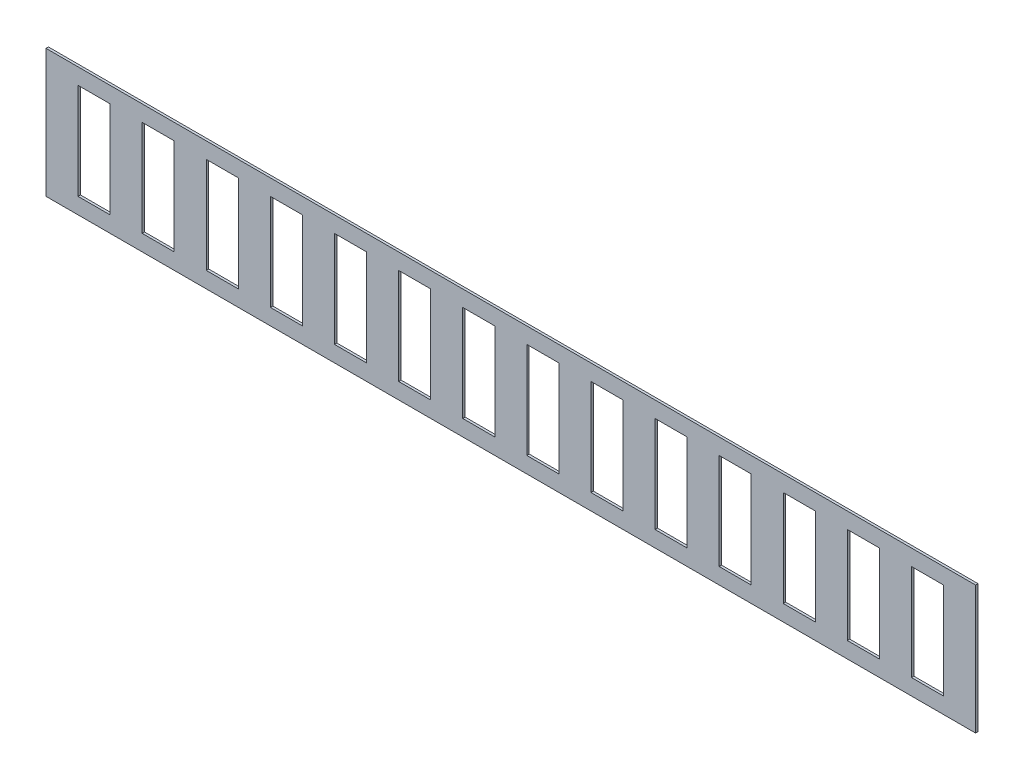
from build123d import *

# Parameters (mm, degrees)
OVEN_PLINT_IZGARA_PANELI_1_START  = 18.5
SKETCH1_W                         = 580
SKETCH1_H                         = 80
OVEN_PLINT_IZGARA_PANELI_1_DEPTH  = 1.5
OVEN_PLINT_IZGARA_PANELI_2_START  = 17
SKETCH2_W                         = 20
SKETCH2_H                         = 60
OVEN_PLINT_IZGARA_PANELI_2_DEPTH  = 4
OVEN_PLINT_IZGARA_PANELI_3_START  = 17
SKETCH3_W                         = 20
SKETCH3_H                         = 60
OVEN_PLINT_IZGARA_PANELI_3_DEPTH  = 4
OVEN_PLINT_IZGARA_PANELI_4_START  = 17
SKETCH4_W                         = 20
SKETCH4_H                         = 60
OVEN_PLINT_IZGARA_PANELI_4_DEPTH  = 4
OVEN_PLINT_IZGARA_PANELI_5_START  = 17
SKETCH5_W                         = 20
SKETCH5_H                         = 60
OVEN_PLINT_IZGARA_PANELI_5_DEPTH  = 4
OVEN_PLINT_IZGARA_PANELI_6_START  = 17
SKETCH6_W                         = 20
SKETCH6_H                         = 60
OVEN_PLINT_IZGARA_PANELI_6_DEPTH  = 4
OVEN_PLINT_IZGARA_PANELI_7_START  = 17
SKETCH7_W                         = 20
SKETCH7_H                         = 60
OVEN_PLINT_IZGARA_PANELI_7_DEPTH  = 4
OVEN_PLINT_IZGARA_PANELI_8_START  = 17
SKETCH8_W                         = 20
SKETCH8_H                         = 60
OVEN_PLINT_IZGARA_PANELI_8_DEPTH  = 4
OVEN_PLINT_IZGARA_PANELI_9_START  = 17
SKETCH9_W                         = 20
SKETCH9_H                         = 60
OVEN_PLINT_IZGARA_PANELI_9_DEPTH  = 4
OVEN_PLINT_IZGARA_PANELI_10_START = 17
SKETCH10_W                        = 20
SKETCH10_H                        = 60
OVEN_PLINT_IZGARA_PANELI_10_DEPTH = 4
OVEN_PLINT_IZGARA_PANELI_11_START = 17
SKETCH11_W                        = 20
SKETCH11_H                        = 60
OVEN_PLINT_IZGARA_PANELI_11_DEPTH = 4
OVEN_PLINT_IZGARA_PANELI_12_START = 17
SKETCH12_W                        = 20
SKETCH12_H                        = 60
OVEN_PLINT_IZGARA_PANELI_12_DEPTH = 4
OVEN_PLINT_IZGARA_PANELI_13_START = 17
SKETCH13_W                        = 20
SKETCH13_H                        = 60
OVEN_PLINT_IZGARA_PANELI_13_DEPTH = 4
OVEN_PLINT_IZGARA_PANELI_14_START = 17
SKETCH14_W                        = 20
SKETCH14_H                        = 60
OVEN_PLINT_IZGARA_PANELI_14_DEPTH = 4
OVEN_PLINT_IZGARA_PANELI_15_START = 17
SKETCH15_W                        = 20
SKETCH15_H                        = 60
OVEN_PLINT_IZGARA_PANELI_15_DEPTH = 4


with BuildPart() as part:
    # Sketch1 → OVEN_plint_izgara_paneli_1 (new body)
    with BuildSketch(Plane.XY.offset(OVEN_PLINT_IZGARA_PANELI_1_START)):
        with Locations((350, 70)):
            Rectangle(SKETCH1_W, SKETCH1_H)
    extrude(amount=OVEN_PLINT_IZGARA_PANELI_1_DEPTH)

    # Sketch2 → OVEN_plint_izgara_paneli_2 (cut)
    with BuildSketch(Plane.XY.offset(OVEN_PLINT_IZGARA_PANELI_2_START)):
        with Locations((90, 70)):
            Rectangle(SKETCH2_W, SKETCH2_H)
    extrude(amount=OVEN_PLINT_IZGARA_PANELI_2_DEPTH, mode=Mode.SUBTRACT)

    # Sketch3 → OVEN_plint_izgara_paneli_3 (cut)
    with BuildSketch(Plane.XY.offset(OVEN_PLINT_IZGARA_PANELI_3_START)):
        with Locations((130, 70)):
            Rectangle(SKETCH3_W, SKETCH3_H)
    extrude(amount=OVEN_PLINT_IZGARA_PANELI_3_DEPTH, mode=Mode.SUBTRACT)

    # Sketch4 → OVEN_plint_izgara_paneli_4 (cut)
    with BuildSketch(Plane.XY.offset(OVEN_PLINT_IZGARA_PANELI_4_START)):
        with Locations((170, 70)):
            Rectangle(SKETCH4_W, SKETCH4_H)
    extrude(amount=OVEN_PLINT_IZGARA_PANELI_4_DEPTH, mode=Mode.SUBTRACT)

    # Sketch5 → OVEN_plint_izgara_paneli_5 (cut)
    with BuildSketch(Plane.XY.offset(OVEN_PLINT_IZGARA_PANELI_5_START)):
        with Locations((210, 70)):
            Rectangle(SKETCH5_W, SKETCH5_H)
    extrude(amount=OVEN_PLINT_IZGARA_PANELI_5_DEPTH, mode=Mode.SUBTRACT)

    # Sketch6 → OVEN_plint_izgara_paneli_6 (cut)
    with BuildSketch(Plane.XY.offset(OVEN_PLINT_IZGARA_PANELI_6_START)):
        with Locations((250, 70)):
            Rectangle(SKETCH6_W, SKETCH6_H)
    extrude(amount=OVEN_PLINT_IZGARA_PANELI_6_DEPTH, mode=Mode.SUBTRACT)

    # Sketch7 → OVEN_plint_izgara_paneli_7 (cut)
    with BuildSketch(Plane.XY.offset(OVEN_PLINT_IZGARA_PANELI_7_START)):
        with Locations((290, 70)):
            Rectangle(SKETCH7_W, SKETCH7_H)
    extrude(amount=OVEN_PLINT_IZGARA_PANELI_7_DEPTH, mode=Mode.SUBTRACT)

    # Sketch8 → OVEN_plint_izgara_paneli_8 (cut)
    with BuildSketch(Plane.XY.offset(OVEN_PLINT_IZGARA_PANELI_8_START)):
        with Locations((330, 70)):
            Rectangle(SKETCH8_W, SKETCH8_H)
    extrude(amount=OVEN_PLINT_IZGARA_PANELI_8_DEPTH, mode=Mode.SUBTRACT)

    # Sketch9 → OVEN_plint_izgara_paneli_9 (cut)
    with BuildSketch(Plane.XY.offset(OVEN_PLINT_IZGARA_PANELI_9_START)):
        with Locations((370, 70)):
            Rectangle(SKETCH9_W, SKETCH9_H)
    extrude(amount=OVEN_PLINT_IZGARA_PANELI_9_DEPTH, mode=Mode.SUBTRACT)

    # Sketch10 → OVEN_plint_izgara_paneli_10 (cut)
    with BuildSketch(Plane.XY.offset(OVEN_PLINT_IZGARA_PANELI_10_START)):
        with Locations((410, 70)):
            Rectangle(SKETCH10_W, SKETCH10_H)
    extrude(amount=OVEN_PLINT_IZGARA_PANELI_10_DEPTH, mode=Mode.SUBTRACT)

    # Sketch11 → OVEN_plint_izgara_paneli_11 (cut)
    with BuildSketch(Plane.XY.offset(OVEN_PLINT_IZGARA_PANELI_11_START)):
        with Locations((450, 70)):
            Rectangle(SKETCH11_W, SKETCH11_H)
    extrude(amount=OVEN_PLINT_IZGARA_PANELI_11_DEPTH, mode=Mode.SUBTRACT)

    # Sketch12 → OVEN_plint_izgara_paneli_12 (cut)
    with BuildSketch(Plane.XY.offset(OVEN_PLINT_IZGARA_PANELI_12_START)):
        with Locations((490, 70)):
            Rectangle(SKETCH12_W, SKETCH12_H)
    extrude(amount=OVEN_PLINT_IZGARA_PANELI_12_DEPTH, mode=Mode.SUBTRACT)

    # Sketch13 → OVEN_plint_izgara_paneli_13 (cut)
    with BuildSketch(Plane.XY.offset(OVEN_PLINT_IZGARA_PANELI_13_START)):
        with Locations((530, 70)):
            Rectangle(SKETCH13_W, SKETCH13_H)
    extrude(amount=OVEN_PLINT_IZGARA_PANELI_13_DEPTH, mode=Mode.SUBTRACT)

    # Sketch14 → OVEN_plint_izgara_paneli_14 (cut)
    with BuildSketch(Plane.XY.offset(OVEN_PLINT_IZGARA_PANELI_14_START)):
        with Locations((570, 70)):
            Rectangle(SKETCH14_W, SKETCH14_H)
    extrude(amount=OVEN_PLINT_IZGARA_PANELI_14_DEPTH, mode=Mode.SUBTRACT)

    # Sketch15 → OVEN_plint_izgara_paneli_15 (cut)
    with BuildSketch(Plane.XY.offset(OVEN_PLINT_IZGARA_PANELI_15_START)):
        with Locations((610, 70)):
            Rectangle(SKETCH15_W, SKETCH15_H)
    extrude(amount=OVEN_PLINT_IZGARA_PANELI_15_DEPTH, mode=Mode.SUBTRACT)


solid = part.part
